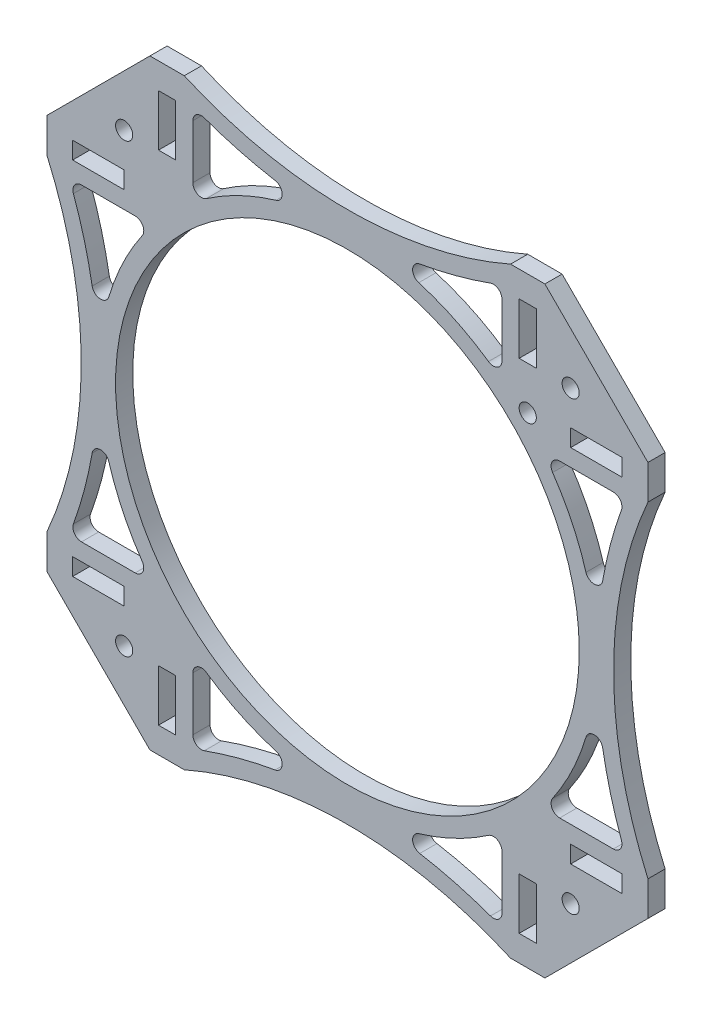
from build123d import *

# Parameters (mm, degrees)
SKETCH1_R           = 27
SKETCH1_R_2         = 1
SKETCH1_W           = 2
SKETCH1_H           = 6
SKETCH1_W_2         = 6
SKETCH1_H_2         = 2
BOSS_EXTRUDE1_DEPTH = 2


with BuildPart() as part:
    # Sketch1 → Boss-Extrude1 (new body)
    with BuildSketch(Plane.XY):
        with BuildLine():
            Line((23, 35), (35, 23))
            Line((35, 23), (35, 19))
            ThreePointArc((35, 19), (31, 0), (35, -19))
            Line((35, -19), (35, -23))
            Line((35, -23), (23, -35))
            Line((23, -35), (19, -35))
            ThreePointArc((19, -35), (0, -31), (-19, -35))
            Line((-19, -35), (-23, -35))
            Line((-23, -35), (-35, -23))
            Line((-35, -23), (-35, -19))
            ThreePointArc((-35, -19), (-31, 0), (-35, 19))
            Line((-35, 19), (-35, 23))
            Line((-35, 23), (-23, 35))
            Line((-23, 35), (-19, 35))
            ThreePointArc((-19, 35), (0, 31), (19, 35))
            Line((19, 35), (23, 35))
        make_face()
        Circle(SKETCH1_R, mode=Mode.SUBTRACT)
        with Locations((26, 26)):
            Circle(SKETCH1_R_2, mode=Mode.SUBTRACT)
        with Locations((21, 21)):
            Circle(SKETCH1_R_2, mode=Mode.SUBTRACT)
        with Locations((26, -26)):
            Circle(SKETCH1_R_2, mode=Mode.SUBTRACT)
        with Locations((-26, -26)):
            Circle(SKETCH1_R_2, mode=Mode.SUBTRACT)
        with Locations((-26, 26)):
            Circle(SKETCH1_R_2, mode=Mode.SUBTRACT)
        with BuildLine():
            Line((18, 30.970831308), (18, 24.718414189))
            ThreePointArc((18, 24.718414189), (17.465474668, 23.833352985), (16.433333333, 23.894467049))
            ThreePointArc((16.433333333, 23.894467049), (12.522883391, 26.15678481), (8.308523463, 27.78432))
            ThreePointArc((8.308523463, 27.78432), (7.59677162, 28.801490124), (8.423552466, 29.727589027))
            ThreePointArc((8.423552466, 29.727589027), (12.589647358, 30.640619364), (16.66084788, 31.911562853))
            ThreePointArc((16.66084788, 31.911562853), (17.574825139, 31.789107582), (18, 30.970831308))
        make_face(mode=Mode.SUBTRACT)
        with BuildLine():
            Line((-18, 30.970831308), (-18, 24.718414189))
            ThreePointArc((-18, 24.718414189), (-17.465474668, 23.833352985), (-16.433333333, 23.894467049))
            ThreePointArc((-16.433333333, 23.894467049), (-12.522883391, 26.156784809), (-8.308523463, 27.78432))
            ThreePointArc((-8.308523463, 27.78432), (-7.59677162, 28.801490124), (-8.423552466, 29.727589027))
            ThreePointArc((-8.423552466, 29.727589027), (-12.589647358, 30.640619364), (-16.66084788, 31.911562853))
            ThreePointArc((-16.66084788, 31.911562853), (-17.574825139, 31.789107582), (-18, 30.970831308))
        make_face(mode=Mode.SUBTRACT)
        with Locations((-21, 29)):
            Rectangle(SKETCH1_W, SKETCH1_H, mode=Mode.SUBTRACT)
        with Locations((21, 29)):
            Rectangle(SKETCH1_W, SKETCH1_H, mode=Mode.SUBTRACT)
        with Locations((29, 21)):
            Rectangle(SKETCH1_W_2, SKETCH1_H_2, mode=Mode.SUBTRACT)
        with Locations((29, -21)):
            Rectangle(SKETCH1_W_2, SKETCH1_H_2, mode=Mode.SUBTRACT)
        with BuildLine():
            Line((30.970831308, 18), (24.718414189, 18))
            ThreePointArc((24.718414189, 18), (23.833352985, 17.465474668), (23.894467049, 16.433333333))
            ThreePointArc((23.894467049, 16.433333333), (26.156784809, 12.522883391), (27.78432, 8.308523463))
            ThreePointArc((27.78432, 8.308523463), (28.801490124, 7.59677162), (29.727589027, 8.423552466))
            ThreePointArc((29.727589027, 8.423552466), (30.640619364, 12.589647358), (31.911562853, 16.66084788))
            ThreePointArc((31.911562853, 16.66084788), (31.789107582, 17.574825139), (30.970831308, 18))
        make_face(mode=Mode.SUBTRACT)
        with BuildLine():
            Line((30.970831308, -18), (24.718414189, -18))
            ThreePointArc((24.718414189, -18), (23.833352985, -17.465474668), (23.894467049, -16.433333333))
            ThreePointArc((23.894467049, -16.433333333), (26.15678481, -12.522883391), (27.78432, -8.308523463))
            ThreePointArc((27.78432, -8.308523463), (28.801490124, -7.59677162), (29.727589027, -8.423552466))
            ThreePointArc((29.727589027, -8.423552466), (30.640619364, -12.589647358), (31.911562853, -16.66084788))
            ThreePointArc((31.911562853, -16.66084788), (31.789107582, -17.574825139), (30.970831308, -18))
        make_face(mode=Mode.SUBTRACT)
        with Locations((21, -29)):
            Rectangle(SKETCH1_W, SKETCH1_H, mode=Mode.SUBTRACT)
        with Locations((-21, -29)):
            Rectangle(SKETCH1_W, SKETCH1_H, mode=Mode.SUBTRACT)
        with BuildLine():
            Line((18, -30.970831308), (18, -24.718414189))
            ThreePointArc((18, -24.718414189), (17.465474668, -23.833352985), (16.433333333, -23.894467049))
            ThreePointArc((16.433333333, -23.894467049), (12.522883391, -26.156784809), (8.308523463, -27.78432))
            ThreePointArc((8.308523463, -27.78432), (7.59677162, -28.801490124), (8.423552466, -29.727589027))
            ThreePointArc((8.423552466, -29.727589027), (12.589647358, -30.640619364), (16.66084788, -31.911562853))
            ThreePointArc((16.66084788, -31.911562853), (17.574825139, -31.789107582), (18, -30.970831308))
        make_face(mode=Mode.SUBTRACT)
        with BuildLine():
            Line((-18, -30.970831308), (-18, -24.718414189))
            ThreePointArc((-18, -24.718414189), (-17.465474668, -23.833352985), (-16.433333333, -23.894467049))
            ThreePointArc((-16.433333333, -23.894467049), (-12.522883391, -26.15678481), (-8.308523463, -27.78432))
            ThreePointArc((-8.308523463, -27.78432), (-7.59677162, -28.801490124), (-8.423552466, -29.727589027))
            ThreePointArc((-8.423552466, -29.727589027), (-12.589647358, -30.640619364), (-16.66084788, -31.911562853))
            ThreePointArc((-16.66084788, -31.911562853), (-17.574825139, -31.789107582), (-18, -30.970831308))
        make_face(mode=Mode.SUBTRACT)
        with Locations((-29, -21)):
            Rectangle(SKETCH1_W_2, SKETCH1_H_2, mode=Mode.SUBTRACT)
        with Locations((-29, 21)):
            Rectangle(SKETCH1_W_2, SKETCH1_H_2, mode=Mode.SUBTRACT)
        with BuildLine():
            Line((-30.970831308, -18), (-24.718414189, -18))
            ThreePointArc((-24.718414189, -18), (-23.833352985, -17.465474668), (-23.894467049, -16.433333333))
            ThreePointArc((-23.894467049, -16.433333333), (-26.156784809, -12.522883391), (-27.78432, -8.308523463))
            ThreePointArc((-27.78432, -8.308523463), (-28.801490124, -7.59677162), (-29.727589027, -8.423552466))
            ThreePointArc((-29.727589027, -8.423552466), (-30.640619364, -12.589647358), (-31.911562853, -16.66084788))
            ThreePointArc((-31.911562853, -16.66084788), (-31.789107582, -17.574825139), (-30.970831308, -18))
        make_face(mode=Mode.SUBTRACT)
        with BuildLine():
            Line((-30.970831308, 18), (-24.718414189, 18))
            ThreePointArc((-24.718414189, 18), (-23.833352985, 17.465474668), (-23.894467049, 16.433333333))
            ThreePointArc((-23.894467049, 16.433333333), (-26.15678481, 12.522883391), (-27.78432, 8.308523463))
            ThreePointArc((-27.78432, 8.308523463), (-28.801490124, 7.59677162), (-29.727589027, 8.423552466))
            ThreePointArc((-29.727589027, 8.423552466), (-30.640619364, 12.589647358), (-31.911562853, 16.66084788))
            ThreePointArc((-31.911562853, 16.66084788), (-31.789107582, 17.574825139), (-30.970831308, 18))
        make_face(mode=Mode.SUBTRACT)
    extrude(amount=BOSS_EXTRUDE1_DEPTH)


solid = part.part
